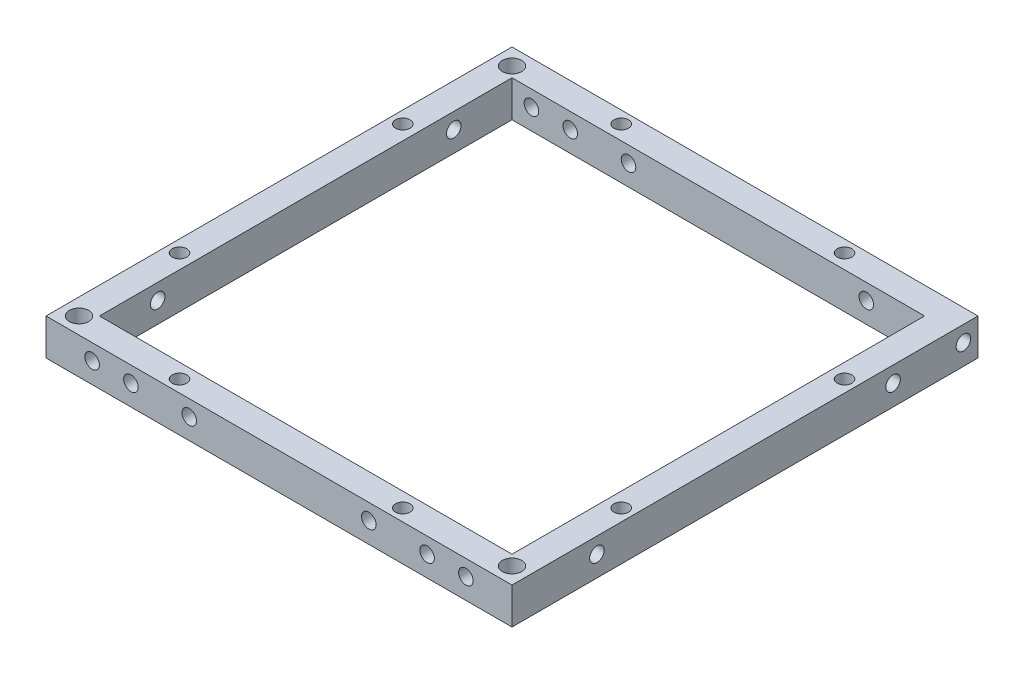
from build123d import *
from build123d.topology import SkipClean

# Parameters (mm, degrees)
SKETCH1_W                               = 96
SKETCH1_H                               = 96
SKETCH1_W_2                             = 80
SKETCH1_H_2                             = 80
BOSS_EXTRUDE1_DEPTH                     = 8
SKETCH27_W                              = 82
SKETCH27_H                              = 82
CUT_EXTRUDE2_DEPTH                      = 10
F_3_0_3_DIAMETER_HOLE1_D                = 3
TAP_DRILL_FOR_M3X0_5_TAP2_D             = 3
SKETCH38_W                              = 85
SKETCH38_H                              = 85
CUT_EXTRUDE4_DEPTH                      = 10
F_3_0_3_DIAMETER_HOLE7_D                = 3
SKETCH44_W                              = 4
SKETCH44_H                              = 4
BOSS_EXTRUDE2_DEPTH                     = 8
SKETCH45_W                              = 4
SKETCH45_H                              = 3.5
BOSS_EXTRUDE3_DEPTH                     = 8
SKETCH49_W                              = 96
SKETCH49_H                              = 1.5
CUT_EXTRUDE5_DEPTH                      = 146
TAP_DRILL_FOR_M4_TAP1_D                 = 4
SKETCH53_W                              = 4
SKETCH53_H                              = 6.5
BOSS_EXTRUDE5_DEPTH                     = 78
SKETCH57_W                              = 4
SKETCH57_H                              = 6.5
CUT_EXTRUDE6_DEPTH                      = 7.5
SKETCH58_W                              = 4
SKETCH58_H                              = 6.5
BOSS_EXTRUDE7_DEPTH                     = 81
SKETCH61_W                              = 32
SKETCH61_H                              = 85
CUT_EXTRUDE7_DEPTH                      = 81
SKETCH66_W                              = 85
SKETCH66_H                              = 80.198
CUT_EXTRUDE8_DEPTH                      = 10
SKETCH67_W                              = 85
SKETCH67_H                              = 85
CUT_EXTRUDE9_DEPTH                      = 3.5
SKETCH68_W                              = 52
SKETCH68_H                              = 85
CUT_EXTRUDE10_DEPTH                     = 56
SKETCH54_W                              = 20
SKETCH54_H                              = 1.45
BOSS_EXTRUDE8_DEPTH                     = 18.5
CUT_EXTRUDE12_START                     = -10.22
SKETCH75_W                              = 2.401
SKETCH75_H                              = 3
CUT_EXTRUDE12_DEPTH                     = 72.44
SKETCH77_W                              = 2.401
SKETCH77_H                              = 3
CUT_EXTRUDE13_DEPTH                     = 6.28
SKETCH78_W                              = 85
SKETCH78_H                              = 85
CUT_EXTRUDE14_DEPTH                     = 6.5
SKETCH79_W                              = 85
SKETCH79_H                              = 85
SKETCH79_W_2                            = 81
SKETCH79_H_2                            = 81
BOSS_EXTRUDE12_DEPTH                    = 6.5
SKETCH82_W                              = 1.25
SKETCH82_H                              = 7.5
TAP_DRILL_FOR_M2_5X0_45_TAP2_AT_2_COUNT = 2
TAP_DRILL_FOR_M2_5X0_45_TAP2_AT_2_PITCH = 9.5
TAP_DRILL_FOR_M2_5X0_45_TAP2_AT_3_COUNT = 2
TAP_DRILL_FOR_M2_5X0_45_TAP2_AT_3_PITCH = 66.500000164
TAP_DRILL_FOR_M2_5X0_45_TAP2_AT_4_COUNT = 2
TAP_DRILL_FOR_M2_5X0_45_TAP2_AT_4_PITCH = 57.000000192
SKETCH84_W                              = 1.25
SKETCH84_H                              = 1.451
TAP_DRILL_FOR_M2_5X0_45_TAP3_AT_2_COUNT = 2
TAP_DRILL_FOR_M2_5X0_45_TAP3_AT_2_PITCH = 9.5
SKETCH86_W                              = 1.5
SKETCH86_H                              = 7.5
SKETCH88_W                              = 2
SKETCH88_H                              = 70
SKETCH88_W_2                            = 70
SKETCH88_H_2                            = 2
CUT_EXTRUDE15_DEPTH                     = 10
SKETCH89_W                              = 85
SKETCH89_H                              = 81
CUT_EXTRUDE16_DEPTH                     = 10
SKETCH90_W                              = 2
SKETCH90_H                              = 6.5
CUT_EXTRUDE17_DEPTH                     = 7.5
SKETCH91_W                              = 96
SKETCH91_H                              = 96
SKETCH91_R                              = 1.5
SKETCH91_R_2                            = 2
BOSS_EXTRUDE14_DEPTH                    = 1
SKETCH92_W                              = 12.5
SKETCH92_H                              = 2
BOSS_EXTRUDE15_DEPTH                    = 1
SKETCH94_W                              = 12.5
SKETCH94_H                              = 2
BOSS_EXTRUDE16_DEPTH                    = 1
SKETCH95_W                              = 12.5
SKETCH95_H                              = 2
BOSS_EXTRUDE17_DEPTH                    = 1
SKETCH96_W                              = 12.5
SKETCH96_H                              = 6.5
SKETCH96_R                              = 1.5
BOSS_EXTRUDE18_DEPTH                    = 2
SKETCH97_W                              = 12.5
SKETCH97_H                              = 6.5
SKETCH97_R                              = 1.5
BOSS_EXTRUDE19_DEPTH                    = 2
CUT_EXTRUDE19_DEPTH                     = 45
CUT_EXTRUDE19_DEPTH_BACK                = 10
SKETCH98_W                              = 85
SKETCH98_H                              = 85
TAP_DRILL_FOR_M3X0_5_TAP5_D             = 3
TAP_DRILL_FOR_M3X0_5_TAP5_DEPTH         = 5.5
TAP_DRILL_FOR_M3X0_5_TAP6_D             = 3


with BuildPart() as part:
    # Sketch1 → Boss-Extrude1 (new body)
    with BuildSketch(Plane(origin=(0, 0, 0), x_dir=(1, 0, 0), z_dir=(0, 1, 0))):
        Rectangle(SKETCH1_W, SKETCH1_H)
        Rectangle(SKETCH1_W_2, SKETCH1_H_2, mode=Mode.SUBTRACT)
    extrude(amount=BOSS_EXTRUDE1_DEPTH)

    # Sketch27 → Cut-Extrude2 (cut)
    with BuildSketch(Plane(origin=(0, 8, 0), x_dir=(1, 0, 0), z_dir=(0, 1, 0))):
        Rectangle(SKETCH27_W, SKETCH27_H)
    extrude(amount=-CUT_EXTRUDE2_DEPTH, mode=Mode.SUBTRACT)

    # Ø3.0 (3) Diameter Hole1 (through all)
    with Locations(Plane.XY.offset(48)):
        with Locations((-30.5, 3.25), (30.5, 3.25)):
            Hole(F_3_0_3_DIAMETER_HOLE1_D / 2)

    # Tap Drill for M3x0.5 Tap2 (through all)
    with Locations(Plane(origin=(0, 0, 0), x_dir=(-1, 0, 0), z_dir=(0, -1, 0))):
        with Locations((23, -45.5), (-23, -45.5), (-45.5, -23), (-45.5, 23), (-23, 45.5), (23, 45.5), (45.5, 23), (45.5, -23)):
            Hole(TAP_DRILL_FOR_M3X0_5_TAP2_D / 2)

    # Sketch38 → Cut-Extrude4 (cut)
    with BuildSketch(Plane(origin=(0, 8, 0), x_dir=(1, 0, 0), z_dir=(0, 1, 0))):
        Rectangle(SKETCH38_W, SKETCH38_H)
    extrude(amount=-CUT_EXTRUDE4_DEPTH, mode=Mode.SUBTRACT)

    # Ø3.0 (3) Diameter Hole7 (through all)
    with Locations(Plane.ZY.offset(48)):
        with Locations((-30.5, 3.25), (30.5, 3.25)):
            Hole(F_3_0_3_DIAMETER_HOLE7_D / 2)

    # Sketch44 → Boss-Extrude2 (add)
    with BuildSketch(Plane.XZ):
        with Locations((40.5, -40.5)):
            Rectangle(SKETCH44_W, SKETCH44_H)
        with Locations((-40.5, -40.5)):
            Rectangle(SKETCH44_W, SKETCH44_H)
        with Locations((-40.5, 40.5)):
            Rectangle(SKETCH44_W, SKETCH44_H)
        with Locations((40.5, 40.5)):
            Rectangle(SKETCH44_W, SKETCH44_H)
    extrude(amount=-BOSS_EXTRUDE2_DEPTH)

    # Sketch45 → Boss-Extrude3 (add)
    with BuildSketch(Plane(origin=(0, 8, 0), x_dir=(1, 0, 0), z_dir=(0, 1, 0))):
        with Locations((-40.5, 36.75)):
            Rectangle(SKETCH45_W, SKETCH45_H)
    extrude(amount=-BOSS_EXTRUDE3_DEPTH)

    # Sketch49 → Cut-Extrude5 (cut)
    with BuildSketch(Plane(origin=(48, 0, 0), x_dir=(0, 0, -1), z_dir=(1, 0, 0))):
        with Locations((0, 7.25)):
            Rectangle(SKETCH49_W, SKETCH49_H)
    extrude(amount=-CUT_EXTRUDE5_DEPTH, mode=Mode.SUBTRACT)

    # Tap Drill for M4 Tap1 (through all)
    with Locations(Plane(origin=(0, 6.5, 0), x_dir=(1, 0, 0), z_dir=(0, 1, 0))):
        with Locations((44.6, -44.6), (-44.6, -44.6), (-44.6, 44.6)):
            Hole(TAP_DRILL_FOR_M4_TAP1_D / 2)

    # Sketch53 → Boss-Extrude5 (add)
    with BuildSketch(Plane(origin=(-38.5, 0, 0), x_dir=(0, 0, -1), z_dir=(1, 0, 0))):
        with Locations((-40.5, 3.25)):
            Rectangle(SKETCH53_W, SKETCH53_H)
    extrude(amount=BOSS_EXTRUDE5_DEPTH)

    # Sketch57 → Cut-Extrude6 (cut)
    with BuildSketch(Plane.XY.offset(-35)):
        with Locations((-40.5, 3.25)):
            Rectangle(SKETCH57_W, SKETCH57_H)
    extrude(amount=-CUT_EXTRUDE6_DEPTH, mode=Mode.SUBTRACT)

    # Sketch58 → Boss-Extrude7 (add)
    with BuildSketch(Plane.ZY.offset(-38.5)):
        with Locations((-40.5, 3.25)):
            Rectangle(SKETCH58_W, SKETCH58_H)
    extrude(amount=BOSS_EXTRUDE7_DEPTH)

    # Sketch61 → Cut-Extrude7 (cut)
    with BuildSketch(Plane(origin=(0, 6.5, 0), x_dir=(1, 0, 0), z_dir=(0, 1, 0))):
        Rectangle(SKETCH61_W, SKETCH61_H)
    extrude(amount=-CUT_EXTRUDE7_DEPTH, mode=Mode.SUBTRACT)

    # Sketch66 → Cut-Extrude8 (cut)
    with BuildSketch(Plane(origin=(0, 6.5, 0), x_dir=(1, 0, 0), z_dir=(0, 1, 0))):
        Rectangle(SKETCH66_W, SKETCH66_H)
    extrude(amount=-CUT_EXTRUDE8_DEPTH, mode=Mode.SUBTRACT)

    # Sketch67 → Cut-Extrude9 (cut)
    with BuildSketch(Plane.XZ):
        Rectangle(SKETCH67_W, SKETCH67_H)
    extrude(amount=-CUT_EXTRUDE9_DEPTH, mode=Mode.SUBTRACT)

    # Sketch68 → Cut-Extrude10 (cut)
    with BuildSketch(Plane(origin=(0, 6.5, 0), x_dir=(1, 0, 0), z_dir=(0, 1, 0))):
        Rectangle(SKETCH68_W, SKETCH68_H)
    extrude(amount=-CUT_EXTRUDE10_DEPTH, mode=Mode.SUBTRACT)

    # Sketch54 → Boss-Extrude8 (add)
    with BuildSketch(Plane(origin=(0, 6.5, 0), x_dir=(1, 0, 0), z_dir=(0, 1, 0))):
        with Locations((-32.5, -41.225)):
            Rectangle(SKETCH54_W, SKETCH54_H)
    boss_extrude8 = extrude(amount=BOSS_EXTRUDE8_DEPTH)

    # Mirror1: Boss-Extrude8 across plane
    add(boss_extrude8.mirror(Plane(origin=(0, 0, 0), x_dir=(0, 0, 1), z_dir=(1, 0, 0))))

    # Sketch75 → Cut-Extrude12 (cut)
    with BuildSketch(Plane.ZY.offset(-26).offset(CUT_EXTRUDE12_START)):
        with Locations((41.2995, 5)):
            Rectangle(SKETCH75_W, SKETCH75_H)
    cut_extrude12 = extrude(amount=CUT_EXTRUDE12_DEPTH, mode=Mode.SUBTRACT)

    # Mirror2: Boss-Extrude8 across plane
    add(boss_extrude8.mirror(Plane.XY))

    # Mirror3: Cut-Extrude12 across plane
    add(cut_extrude12.mirror(Plane.XY), mode=Mode.SUBTRACT)

    # Sketch77 → Cut-Extrude13 (cut)
    with BuildSketch(Plane.ZY.offset(-36.22)):
        with Locations((-41.2995, 5)):
            Rectangle(SKETCH77_W, SKETCH77_H)
    extrude(amount=-CUT_EXTRUDE13_DEPTH, mode=Mode.SUBTRACT)

    # Sketch78 → Cut-Extrude14 (cut)
    with BuildSketch(Plane.XZ):
        Rectangle(SKETCH78_W, SKETCH78_H)
    extrude(amount=-CUT_EXTRUDE14_DEPTH, mode=Mode.SUBTRACT)


with BuildPart() as cut_extrude14_piece_1:
    # of the separate pieces the step leaves, piece 1, a body of its own (cut_extrude14_pieces)
    add(part.part.solids().sort_by_distance((48, 0, 48))[0])

    # Sketch79 → Boss-Extrude12 (add)
    with BuildSketch(Plane.XZ):
        Rectangle(SKETCH79_W, SKETCH79_H)
        Rectangle(SKETCH79_W_2, SKETCH79_H_2, mode=Mode.SUBTRACT)
    extrude(amount=-BOSS_EXTRUDE12_DEPTH)

    # Sketch86 → Tap Drill for M3x0.5 Tap4 (revolve, cut)
    with BuildSketch(Plane(origin=(48, 3.25, -45), x_dir=(0, 0, -1), z_dir=(0, 1, 0))):
        with Locations((0.75, 3.75)):
            Rectangle(SKETCH86_W, SKETCH86_H)
    revolve(axis=Axis((54.35, 3.25, -45), (-1, 0, 0)), mode=Mode.SUBTRACT)

    # Sketch88 → Cut-Extrude15 (cut)
    with BuildSketch(Plane(origin=(0, 6.5, 0), x_dir=(1, 0, 0), z_dir=(0, 1, 0))):
        with Locations((41.5, 0)):
            Rectangle(SKETCH88_W, SKETCH88_H)
        with Locations((0, -41.5)):
            Rectangle(SKETCH88_W_2, SKETCH88_H_2)
        with Locations((-41.5, 0)):
            Rectangle(SKETCH88_W, SKETCH88_H)
        with Locations((0, 41.5)):
            Rectangle(SKETCH88_W_2, SKETCH88_H_2)
    extrude(amount=-CUT_EXTRUDE15_DEPTH, mode=Mode.SUBTRACT)

    # Sketch89 → Cut-Extrude16 (cut)
    with BuildSketch(Plane(origin=(0, 6.5, 0), x_dir=(1, 0, 0), z_dir=(0, 1, 0))):
        Rectangle(SKETCH89_W, SKETCH89_H)
    extrude(amount=-CUT_EXTRUDE16_DEPTH, mode=Mode.SUBTRACT)

    # Sketch90 → Cut-Extrude17 (cut)
    with BuildSketch(Plane.ZY.offset(-35)):
        with Locations((-41.5, 3.25)):
            Rectangle(SKETCH90_W, SKETCH90_H)
    extrude(amount=-CUT_EXTRUDE17_DEPTH, mode=Mode.SUBTRACT)

    # Sketch91 → Boss-Extrude14 (add)
    with SkipClean():  # the faces are left unmerged after this step: merging them gives an invalid solid
        with BuildSketch(Plane.XZ):
            Rectangle(SKETCH91_W, SKETCH91_H)
            with Locations(Location((23, -45.5, 0), (0, 0, 270))):
                Circle(SKETCH91_R, mode=Mode.SUBTRACT)
            with Locations(Location((-23, -45.5, 0), (0, 0, 270))):
                Circle(SKETCH91_R, mode=Mode.SUBTRACT)
            with Locations(Location((44.6, 44.6, 0), (0, 0, 90))):
                Circle(SKETCH91_R_2, mode=Mode.SUBTRACT)
            with Locations(Location((-45.5, -23, 0), (0, 0, 270))):
                Circle(SKETCH91_R, mode=Mode.SUBTRACT)
            with Locations(Location((-45.5, 23, 0), (0, 0, 270))):
                Circle(SKETCH91_R, mode=Mode.SUBTRACT)
            with Locations(Location((-23, 45.5, 0), (0, 0, 270))):
                Circle(SKETCH91_R, mode=Mode.SUBTRACT)
            with Locations(Location((23, 45.5, 0), (0, 0, 270))):
                Circle(SKETCH91_R, mode=Mode.SUBTRACT)
            with Locations(Location((45.5, 23, 0), (0, 0, 270))):
                Circle(SKETCH91_R, mode=Mode.SUBTRACT)
            with Locations(Location((-44.6, -44.6, 0), (0, 0, 90))):
                Circle(SKETCH91_R_2, mode=Mode.SUBTRACT)
            with Locations(Location((45.5, -23, 0), (0, 0, 270))):
                Circle(SKETCH91_R, mode=Mode.SUBTRACT)
            with Locations(Location((-44.6, 44.6, 0), (0, 0, 90))):
                Circle(SKETCH91_R_2, mode=Mode.SUBTRACT)
            Polygon((42.5, -42.5), (-35, -42.5), (-35, -40.5), (-42.5, -40.5), (-42.5, 40.5), (-35, 40.5), (-35, 42.5), (35, 42.5), (35, 40.5), (42.5, 40.5), align=None, mode=Mode.SUBTRACT)
        extrude(amount=BOSS_EXTRUDE14_DEPTH)



with BuildPart() as cut_extrude14_piece_2:
    # of the separate pieces the step leaves, piece 2, a body of its own (cut_extrude14_pieces)
    add(part.part.solids().sort_by_distance((-42.5, 25, -40.5))[0])

    # Sketch84 → Tap Drill for M2.5x0.45 Tap3 (revolve, cut)
    with BuildSketch(Plane(origin=(-28.5, 21.425324496, -40.5), x_dir=(0, -1, 0), z_dir=(1, 0, 0))):
        with Locations((0.625, 0.7255)):
            Rectangle(SKETCH84_W, SKETCH84_H)
    tap_drill_for_m2_5x0_45_tap3 = revolve(axis=Axis((-28.5, 21.425324496, -34.15), (0, 0, -1)), mode=Mode.SUBTRACT)

    # Tap Drill for M2.5x0.45 Tap3 at 2: Tap Drill for M2.5x0.45 Tap3 ×2
    with Locations(*[(-i * TAP_DRILL_FOR_M2_5X0_45_TAP3_AT_2_PITCH, 0, 0) for i in range(1, TAP_DRILL_FOR_M2_5X0_45_TAP3_AT_2_COUNT)]):
        add(tap_drill_for_m2_5x0_45_tap3, mode=Mode.SUBTRACT)


with BuildPart() as cut_extrude14_piece_3:
    # of the separate pieces the step leaves, piece 3, a body of its own (cut_extrude14_pieces)
    add(part.part.solids().sort_by_distance((-42.5, 25, 40.5))[0])

    # Sketch82 → Tap Drill for M2.5x0.45 Tap2 (revolve, cut)
    with BuildSketch(Plane(origin=(-28.5, 21.425324496, 40.5), x_dir=(0, 1, 0), z_dir=(1, 0, 0))):
        with Locations((0.625, 3.75)):
            Rectangle(SKETCH82_W, SKETCH82_H)
    tap_drill_for_m2_5x0_45_tap2 = revolve(axis=Axis((-28.5, 21.425324496, 34.15), (0, 0, 1)), mode=Mode.SUBTRACT)

    # Tap Drill for M2.5x0.45 Tap2 at 2: Tap Drill for M2.5x0.45 Tap2 ×2
    with Locations(*[(-i * TAP_DRILL_FOR_M2_5X0_45_TAP2_AT_2_PITCH, 0, 0) for i in range(1, TAP_DRILL_FOR_M2_5X0_45_TAP2_AT_2_COUNT)]):
        add(tap_drill_for_m2_5x0_45_tap2, mode=Mode.SUBTRACT)


with BuildPart() as cut_extrude14_piece_4:
    # of the separate pieces the step leaves, piece 4, a body of its own (cut_extrude14_pieces)
    add(part.part.solids().sort_by_distance((42.5, 25, 40.5))[0])

    # Tap Drill for M2.5x0.45 Tap2 at 3: Tap Drill for M2.5x0.45 Tap2 ×2
    with Locations(*[Vector(0.9999999975283697, 7.030832685372667e-05, 0) * (i * TAP_DRILL_FOR_M2_5X0_45_TAP2_AT_3_PITCH) for i in range(1, TAP_DRILL_FOR_M2_5X0_45_TAP2_AT_3_COUNT)]):
        add(tap_drill_for_m2_5x0_45_tap2, mode=Mode.SUBTRACT)

    # Tap Drill for M2.5x0.45 Tap2 at 4: Tap Drill for M2.5x0.45 Tap2 ×2
    with Locations(*[Vector(0.9999999966358364, 8.202638125607419e-05, 0) * (i * TAP_DRILL_FOR_M2_5X0_45_TAP2_AT_4_PITCH) for i in range(1, TAP_DRILL_FOR_M2_5X0_45_TAP2_AT_4_COUNT)]):
        add(tap_drill_for_m2_5x0_45_tap2, mode=Mode.SUBTRACT)


with BuildPart() as cut_extrude14_piece_1_1:
    with SkipClean():  # the faces are left unmerged after this step: merging them gives an invalid solid
        add(cut_extrude14_piece_1.part)

        add(cut_extrude14_piece_3.part)  # Boss-Extrude15 merges Cut-Extrude14 piece 3
        # Sketch92 → Boss-Extrude15 (add)
        with BuildSketch(Plane.XZ.offset(-6.5)):
            with Locations((-28.75, 41.5)):
                Rectangle(SKETCH92_W, SKETCH92_H)
        extrude(amount=BOSS_EXTRUDE15_DEPTH)


    with SkipClean():  # the faces are left unmerged after this step: merging them gives an invalid solid
        add(cut_extrude14_piece_4.part)  # Boss-Extrude16 merges Cut-Extrude14 piece 4
        # Sketch94 → Boss-Extrude16 (add)
        with BuildSketch(Plane.XZ.offset(-6.5)):
            with Locations((28.75, 41.5)):
                Rectangle(SKETCH94_W, SKETCH94_H)
        extrude(amount=BOSS_EXTRUDE16_DEPTH)


    with SkipClean():  # the faces are left unmerged after this step: merging them gives an invalid solid
        add(cut_extrude14_piece_2.part)  # Boss-Extrude17 merges Cut-Extrude14 piece 2
        # Sketch95 → Boss-Extrude17 (add)
        with BuildSketch(Plane.XZ.offset(-6.5)):
            with Locations((-28.75, -41.5)):
                Rectangle(SKETCH95_W, SKETCH95_H)
        extrude(amount=BOSS_EXTRUDE17_DEPTH)

    # Sketch96 → Boss-Extrude18 (add)
    with SkipClean():  # the faces are left unmerged after this step: merging them gives an invalid solid
        with BuildSketch(Plane.XY.offset(-42.5)):
            with Locations((-28.75, 2.25)):
                Rectangle(SKETCH96_W, SKETCH96_H)
            with Locations((-30.5, 3.25)):
                Circle(SKETCH96_R, mode=Mode.SUBTRACT)
        extrude(amount=BOSS_EXTRUDE18_DEPTH)

    # Sketch97 → Boss-Extrude19 (add)
    # profile 1 of 2: a face of its own
    with SkipClean():  # the faces are left unmerged after this step: merging them gives an invalid solid
        with BuildSketch(Plane(origin=(0, 0, 42.5), x_dir=(-1, 0, 0), z_dir=(0, 0, -1))):
            with Locations((-28.75, 2.25)):
                Rectangle(SKETCH97_W, SKETCH97_H)
            with Locations(Location((-30.5, 3.25, 0), (0, 0, 180))):
                Circle(SKETCH97_R, mode=Mode.SUBTRACT)
        # profile 2 of 2: a face of its own
        with BuildSketch(Plane(origin=(0, 0, 42.5), x_dir=(-1, 0, 0), z_dir=(0, 0, -1))):
            with Locations((28.75, 2.25)):
                Rectangle(SKETCH97_W, SKETCH97_H)
            with Locations(Location((30.5, 3.25, 0), (0, 0, 180))):
                Circle(SKETCH97_R, mode=Mode.SUBTRACT)
        extrude(amount=BOSS_EXTRUDE19_DEPTH)

    # Sketch98 → Cut-Extrude19 (cut, two sides: drawn at the far end of the back side and taken through both)
    with SkipClean():  # the faces are left unmerged after this step: merging them gives an invalid solid
        with BuildSketch(Plane(origin=(0, 6.5, 0), x_dir=(1, 0, 0), z_dir=(0, 1, 0)).offset(-CUT_EXTRUDE19_DEPTH_BACK)):
            Rectangle(SKETCH98_W, SKETCH98_H)
        extrude(amount=CUT_EXTRUDE19_DEPTH + CUT_EXTRUDE19_DEPTH_BACK, mode=Mode.SUBTRACT)

    # Tap Drill for M3x0.5 Tap5
    with Locations(Plane(origin=(0, 0, 42.5), x_dir=(-1, 0, 0), z_dir=(0, 0, -1))):
        with Locations((38.5, 3.25), (18.5, 3.25), (-18.5, 3.25), (-38.5, 3.25)):
            Hole(TAP_DRILL_FOR_M3X0_5_TAP5_D / 2, depth=TAP_DRILL_FOR_M3X0_5_TAP5_DEPTH)

    # Tap Drill for M3x0.5 Tap6 (through all)
    with Locations(Plane.XY.offset(-42.5)):
        with Locations((-38.5, 3.25), (-18.5, 3.25)):
            Hole(TAP_DRILL_FOR_M3X0_5_TAP6_D / 2)


solid = cut_extrude14_piece_1_1.part
